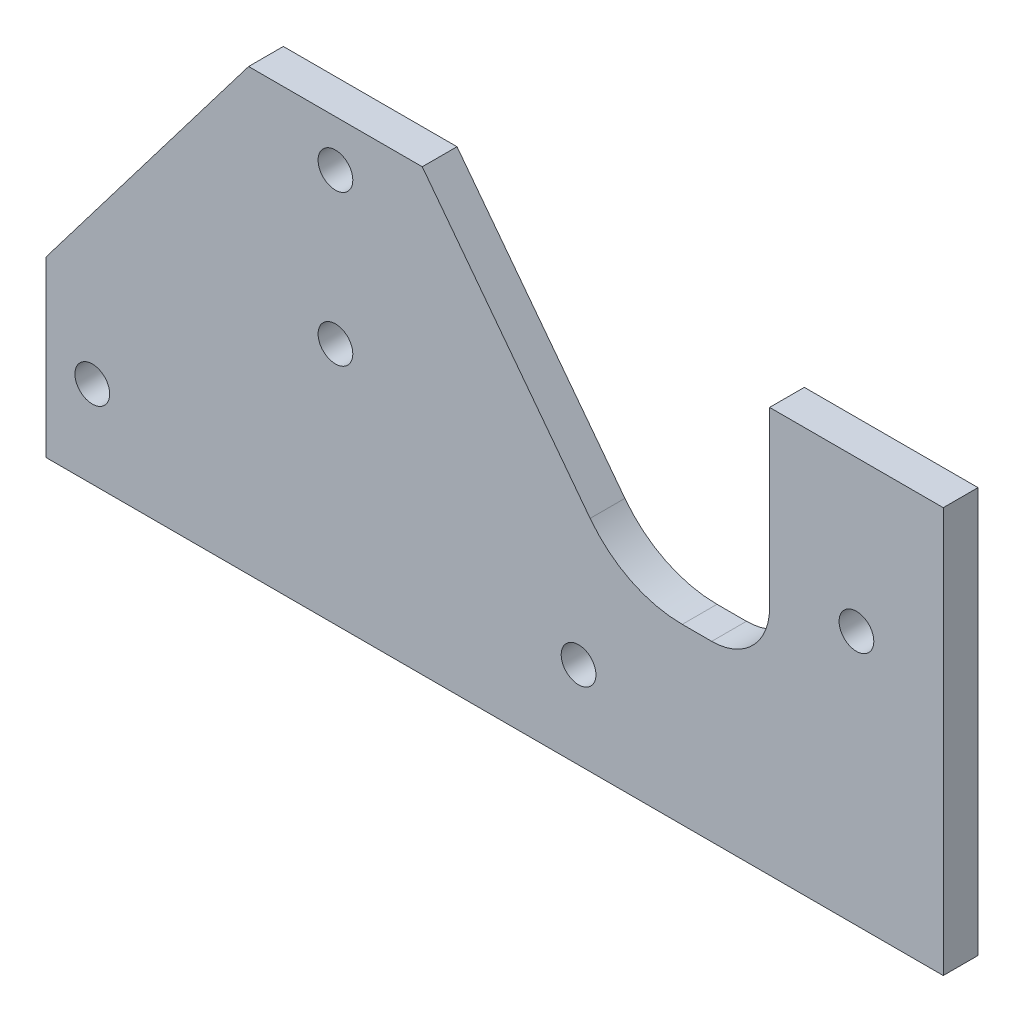
from build123d import *

# Parameters (mm, degrees)
EXTRUDE_1_DEPTH     = 3
SKETCH_2_R          = 1.5
CUT_EXTRUDE_1_DEPTH = 3


with BuildPart() as part:
    # 草图1 → 凸台-拉伸1 (new body)
    with BuildSketch(Plane.XY):
        with BuildLine():
            Line((0, 0), (15, 0))
            Line((15, 0), (29.498535682, -19.055218325))
            ThreePointArc((29.498535682, -19.055218325), (33.015661922, -21.959692608), (37.456822623, -23))
            Line((37.456822623, -23), (40, -23))
            ThreePointArc((40, -23), (43.535533906, -21.535533906), (45, -18))
            Line((45, -18), (45, -3))
            Line((45, -3), (60, -3))
            Line((60, -3), (60, -38))
            Line((60, -38), (-17.5, -38))
            Line((-17.5, -38), (-17.5, -23))
            Line((-17.5, -23), (0, 0))
        make_face()
    extrude(amount=EXTRUDE_1_DEPTH)

    # 草图2 → 切除-拉伸1 (cut)
    with BuildSketch(Plane.XY.offset(3)):
        with Locations((-13.5, -30.5)):
            Circle(SKETCH_2_R)
        with Locations((28.5, -30.5)):
            Circle(SKETCH_2_R)
        with Locations((7.5, -4)):
            Circle(SKETCH_2_R)
        with Locations((7.5, -17)):
            Circle(SKETCH_2_R)
        with Locations((52.5, -16)):
            Circle(SKETCH_2_R)
    extrude(amount=-CUT_EXTRUDE_1_DEPTH, mode=Mode.SUBTRACT)


solid = part.part
